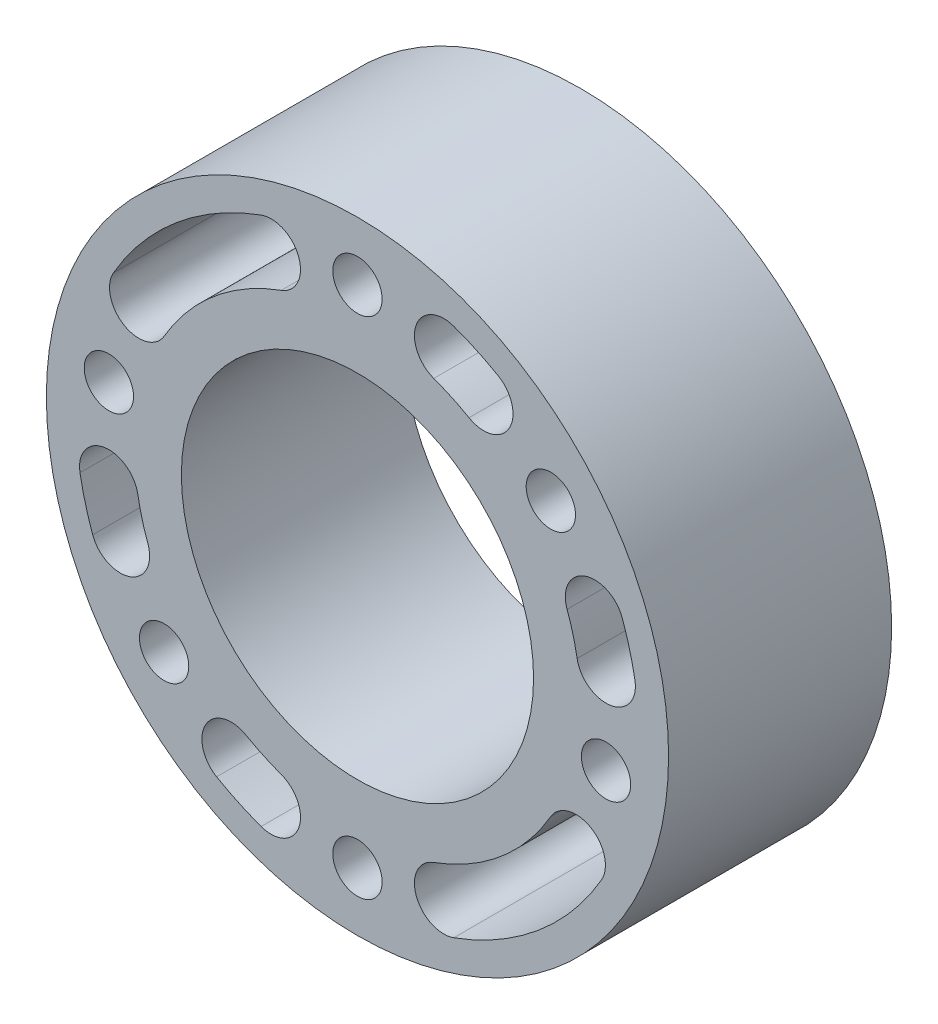
from build123d import *

# Parameters (mm, degrees)
SKETCH_1_R      = 26.5
SKETCH_1_R_2    = 15
SKETCH_1_R_3    = 2.1
EXTRUDE_1_DEPTH = 19


with BuildPart() as part:
    # 草图1 → 凸台-拉伸1 (new body)
    with BuildSketch(Plane.XY):
        Circle(SKETCH_1_R)
        Circle(SKETCH_1_R_2, mode=Mode.SUBTRACT)
        with Locations((0, 21.5)):
            Circle(SKETCH_1_R_3, mode=Mode.SUBTRACT)
        with Locations((16.469955527, 13.819933608)):
            Circle(SKETCH_1_R_3, mode=Mode.SUBTRACT)
        with Locations((21.17336669, -3.73343582)):
            Circle(SKETCH_1_R_3, mode=Mode.SUBTRACT)
        with Locations((0, -21.5)):
            Circle(SKETCH_1_R_3, mode=Mode.SUBTRACT)
        with Locations((-16.469955527, -13.819933608)):
            Circle(SKETCH_1_R_3, mode=Mode.SUBTRACT)
        with Locations((-21.17336669, 3.73343582)):
            Circle(SKETCH_1_R_3, mode=Mode.SUBTRACT)
        with BuildLine():
            ThreePointArc((-8.20848344, 22.552622899), (-15.426902632, 18.385066635), (-20.784609691, 12))
            ThreePointArc((-20.784609691, 12), (-19.869546181, 8.584936491), (-16.454482672, 9.5))
            ThreePointArc((-16.454482672, 9.5), (-12.212964584, 14.554844419), (-6.498382723, 17.854159795))
            ThreePointArc((-6.498382723, 17.854159795), (-5.00420153, 21.058441705), (-8.20848344, 22.552622899))
        make_face(mode=Mode.SUBTRACT)
        with BuildLine():
            ThreePointArc((12, 20.784609691), (10.142838282, 21.751386889), (8.20848344, 22.552622899))
            ThreePointArc((8.20848344, 22.552622899), (5.00420153, 21.058441705), (6.498382723, 17.854159795))
            ThreePointArc((6.498382723, 17.854159795), (8.029746973, 17.219847954), (9.5, 16.454482672))
            ThreePointArc((9.5, 16.454482672), (12.915063509, 17.369546181), (12, 20.784609691))
        make_face(mode=Mode.SUBTRACT)
        with BuildLine():
            ThreePointArc((18.711347307, 3.299315376), (18.352590699, 4.917561857), (17.854159795, 6.498382723))
            ThreePointArc((17.854159795, 6.498382723), (19.348340989, 9.702664633), (22.552622899, 8.20848344))
            ThreePointArc((22.552622899, 8.20848344), (23.182219831, 6.211657082), (23.635386072, 4.167556264))
            ThreePointArc((23.635386072, 4.167556264), (21.607487134, 1.271416437), (18.711347307, 3.299315376))
        make_face(mode=Mode.SUBTRACT)
        with BuildLine():
            ThreePointArc((6.498382723, -17.854159795), (12.212964584, -14.554844419), (16.454482672, -9.5))
            ThreePointArc((16.454482672, -9.5), (19.869546181, -8.584936491), (20.784609691, -12))
            ThreePointArc((20.784609691, -12), (15.426902632, -18.385066635), (8.20848344, -22.552622899))
            ThreePointArc((8.20848344, -22.552622899), (5.00420153, -21.058441705), (6.498382723, -17.854159795))
        make_face(mode=Mode.SUBTRACT)
        with BuildLine():
            ThreePointArc((-9.5, -16.454482672), (-8.029746973, -17.219847954), (-6.498382723, -17.854159795))
            ThreePointArc((-6.498382723, -17.854159795), (-5.00420153, -21.058441705), (-8.20848344, -22.552622899))
            ThreePointArc((-8.20848344, -22.552622899), (-10.142838282, -21.751386889), (-12, -20.784609691))
            ThreePointArc((-12, -20.784609691), (-12.915063509, -17.369546181), (-9.5, -16.454482672))
        make_face(mode=Mode.SUBTRACT)
        with BuildLine():
            ThreePointArc((-23.635386072, -4.167556264), (-23.182219831, -6.211657082), (-22.552622899, -8.20848344))
            ThreePointArc((-22.552622899, -8.20848344), (-19.348340989, -9.702664633), (-17.854159795, -6.498382723))
            ThreePointArc((-17.854159795, -6.498382723), (-18.352590699, -4.917561857), (-18.711347307, -3.299315376))
            ThreePointArc((-18.711347307, -3.299315376), (-21.607487134, -1.271416437), (-23.635386072, -4.167556264))
        make_face(mode=Mode.SUBTRACT)
    extrude(amount=EXTRUDE_1_DEPTH)


solid = part.part
